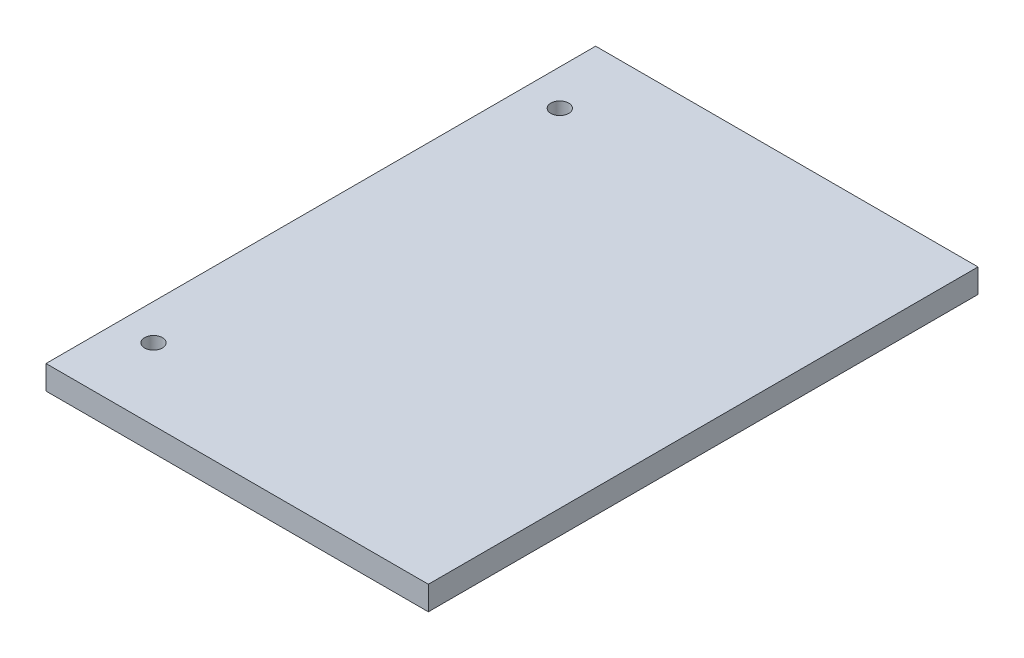
from build123d import *

# Parameters (mm, degrees)
SKETCH1_W           = 101.6
SKETCH1_H           = 146.05
BOSS_EXTRUDE1_DEPTH = 6.35
SKETCH2_R           = 2.38125
CUT_EXTRUDE1_DEPTH  = 6.35


with BuildPart() as part:
    # Sketch1 → Boss-Extrude1 (new body)
    with BuildSketch(Plane(origin=(0, 0, 0), x_dir=(1, 0, 0), z_dir=(0, 1, 0))):
        with Locations((50.8, -73.025)):
            Rectangle(SKETCH1_W, SKETCH1_H)
    extrude(amount=BOSS_EXTRUDE1_DEPTH)

    # Sketch2 → Cut-Extrude1 (cut)
    with BuildSketch(Plane(origin=(0, 6.35, 0), x_dir=(1, 0, 0), z_dir=(0, 1, 0))):
        with Locations(Location((9.525, -19.05, 0), (0, 0, 270))):
            Circle(SKETCH2_R)
        with Locations(Location((9.525, -127, 0), (0, 0, 270))):
            Circle(SKETCH2_R)
    extrude(amount=-CUT_EXTRUDE1_DEPTH, mode=Mode.SUBTRACT)


solid = part.part
